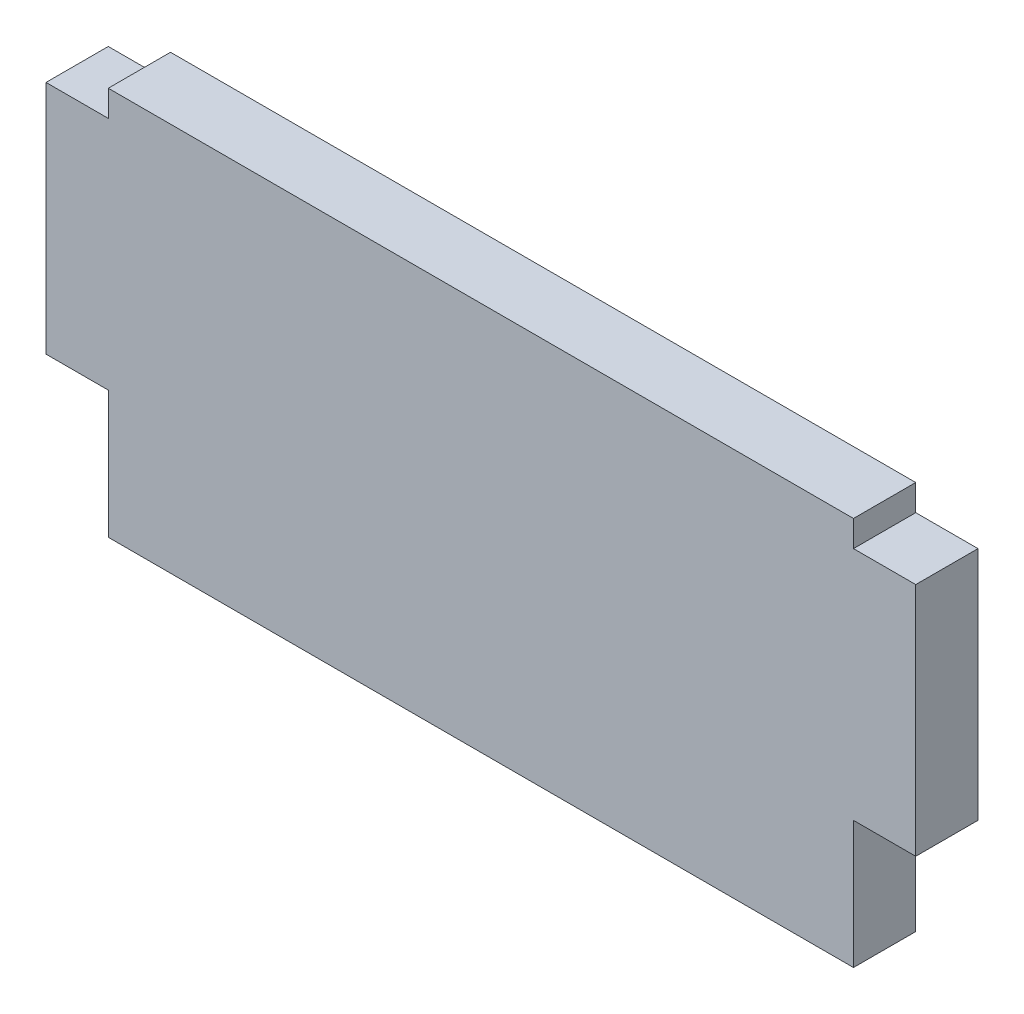
from build123d import *

# Parameters (mm, degrees)
SKETCH1_W           = 3.175
SKETCH1_H           = 12
SKETCH1_H_2         = 18
BOSS_EXTRUDE1_DEPTH = 3.175
SKETCH2_W           = 32.65
SKETCH2_H           = 2
BOSS_EXTRUDE2_DEPTH = 3.175
SKETCH3_W           = 3.175
SKETCH3_H           = 1.331730769
CUT_EXTRUDE2_DEPTH  = 10
SKETCH5_W           = 5.35
SKETCH5_H           = 2
BOSS_EXTRUDE5_DEPTH = 3.175


with BuildPart() as part:
    # Sketch1 → Boss-Extrude1 (new body)
    with BuildSketch(Plane.XY):
        Polygon((19, 5.331730769), (-19, 12.5), (-19, 10), (-19, -8), (-19, -12.5), (19, -12.5), (19, -8), (19, 4), align=None)
        with Locations((20.5875, -2)):
            Rectangle(SKETCH1_W, SKETCH1_H)
        with Locations((-20.5875, 1)):
            Rectangle(SKETCH1_W, SKETCH1_H_2)
    extrude(amount=BOSS_EXTRUDE1_DEPTH)

    # Sketch2 → Boss-Extrude2 (add)
    with BuildSketch(Plane.XY.offset(3.175)):
        with Locations((2.675, -13.5)):
            Rectangle(SKETCH2_W, SKETCH2_H)
    extrude(amount=-BOSS_EXTRUDE2_DEPTH)

    # Sketch3 → Cut-Extrude2 (cut)
    with BuildSketch(Plane.XY.offset(3.175)):
        with Locations((-20.5875, 4.665865384)):
            Rectangle(SKETCH3_W, SKETCH3_H)
        Polygon((-19, 5.331730769), (-19, 9.853630911), (-19, 10), (-22.175, 10), (-22.175, 5.331730769), align=None)
        Polygon((-19, 10), (-19, 9.853630911), (-19, 5.331730769), (19, 5.331730769), (-11.823223146, 11.146182403), (-19, 11.146182403), align=None)
        Polygon((-19, 12.5), (-19, 11.146182403), (-11.823223146, 11.146182403), align=None)
    extrude(amount=-CUT_EXTRUDE2_DEPTH, mode=Mode.SUBTRACT)

    # Sketch5 → Boss-Extrude5 (add)
    with BuildSketch(Plane.XY.offset(3.175)):
        with Locations((-16.325, -13.5)):
            Rectangle(SKETCH5_W, SKETCH5_H)
    extrude(amount=-BOSS_EXTRUDE5_DEPTH)


solid = part.part
